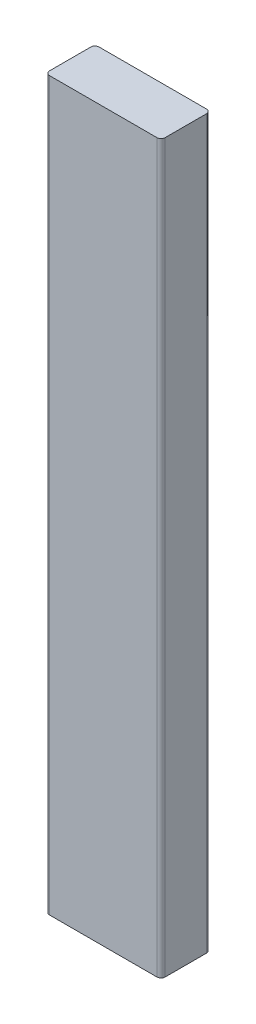
from build123d import *

# Parameters (mm, degrees)
BOSS_EXTRUDE1_DEPTH = 558.8


with BuildPart() as part:
    # Sketch1 → Boss-Extrude1 (new body)
    with BuildSketch(Plane(origin=(0, 0, 0), x_dir=(1, 0, 0), z_dir=(0, 1, 0))):
        with BuildLine():
            Line((41.275, -19.05), (-41.275, -19.05))
            ThreePointArc((-41.275, -19.05), (-43.52006403, -18.12006403), (-44.45, -15.875))
            Line((-44.45, -15.875), (-44.45, 15.875))
            ThreePointArc((-44.45, 15.875), (-43.52006403, 18.12006403), (-41.275, 19.05))
            Line((-41.275, 19.05), (41.275, 19.05))
            ThreePointArc((41.275, 19.05), (43.52006403, 18.12006403), (44.45, 15.875))
            Line((44.45, 15.875), (44.45, -15.875))
            ThreePointArc((44.45, -15.875), (43.52006403, -18.12006403), (41.275, -19.05))
        make_face()
    extrude(amount=BOSS_EXTRUDE1_DEPTH)


solid = part.part
